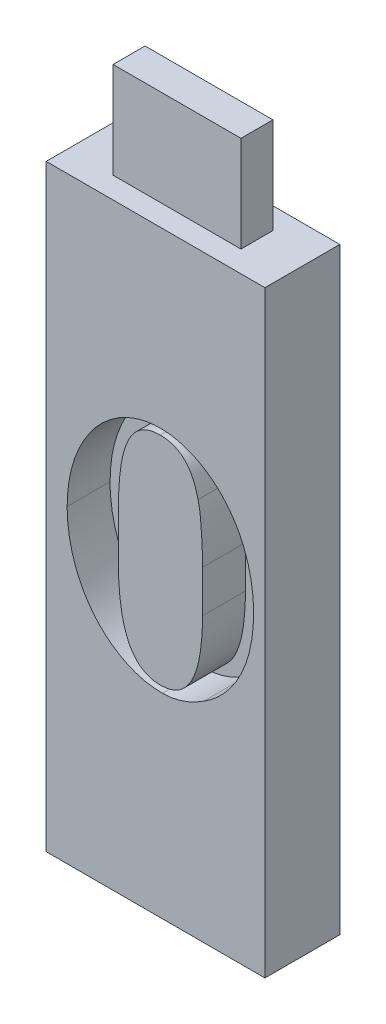
from build123d import *

# Parameters (mm, degrees)
SKETCH1_W           = 17.38
SKETCH1_H           = 47.498
BOSS_EXTRUDE1_DEPTH = 5.95
CUT_EXTRUDE1_DEPTH  = 3.41
SKETCH3_W           = 10.16
SKETCH3_H           = 2.54
BOSS_EXTRUDE2_DEPTH = 7.62


with BuildPart() as part:
    # Sketch1 → Boss-Extrude1 (new body)
    with BuildSketch(Plane.XY):
        Rectangle(SKETCH1_W, SKETCH1_H)
    extrude(amount=BOSS_EXTRUDE1_DEPTH)

    # Sketch2 → Cut-Extrude1 (cut)
    with BuildSketch(Plane.XY.offset(5.95)):
        with BuildLine():
            add(Edge.make_bspline(
                [(0.550302732, -8.226542522), (0.379735674, -8.222982783), (0.040169774, -8.215896034), (-0.463839474, -8.15812923), (-0.957953156, -8.065305599), (-1.440722609, -7.93397308), (-1.914246856, -7.765779149), (-2.375520379, -7.555268135), (-2.829688826, -7.311649662), (-3.271985998, -7.033523648), (-3.695622296, -6.719710376), (-4.100608986, -6.379462985), (-4.482356898, -6.010283848), (-4.834867943, -5.609039062), (-5.170252218, -5.186152795), (-5.479691278, -4.732982281), (-5.767177385, -4.252361088), (-6.026195622, -3.745122286), (-6.262649235, -3.220813492), (-6.463385677, -2.677755241), (-6.63458604, -2.121971034), (-6.777705411, -1.554373675), (-6.884857685, -0.974513718), (-6.963012588, -0.382925268), (-7.013958172, 0.222378933), (-7.018848737, 0.631170896), (-7.021320272, 0.837761211)],
                knots=[0, 0, 0, 0, 0.935229359, 1.861860104, 2.778365642, 3.690213086, 4.602953262, 5.531139642, 6.468158725, 7.427752723, 8.393775505, 9.35721743, 10.326918663, 11.30305363, 12.284324182, 13.285316018, 14.310199044, 15.353667505, 16.407211588, 17.462763663, 18.526572315, 19.595421863, 20.671172186, 21.758519085, 22.867227609, 24, 24, 24, 24], degree=3))
            add(Edge.make_bspline(
                [(-7.021320272, 0.837761211), (-7.019018375, 1.043132905), (-7.014463737, 1.449490733), (-6.960970524, 2.051780421), (-6.891552806, 2.643471616), (-6.774881724, 3.22130983), (-6.639867653, 3.790672361), (-6.466996952, 4.345851556), (-6.265031095, 4.888970049), (-6.033789785, 5.416782083), (-5.779586146, 5.927183042), (-5.493336967, 6.408001352), (-5.191668967, 6.865492143), (-4.867252969, 7.295030074), (-4.519766848, 7.695667308), (-4.148181052, 8.065835718), (-3.757073623, 8.410721014), (-3.34206406, 8.721642737), (-2.915815576, 9.008687913), (-2.469246401, 9.247584189), (-2.017296753, 9.462224383), (-1.549212621, 9.625945007), (-1.073318626, 9.765137224), (-0.584345141, 9.855228751), (-0.084297826, 9.914279226), (0.252836758, 9.921036178), (0.42342487, 9.924455156)],
                knots=[0, 0, 0, 0, 1.133047579, 2.241899783, 3.335215261, 4.419027891, 5.492968413, 6.563480614, 7.625684211, 8.689373082, 9.742419676, 10.770259333, 11.775568516, 12.765501156, 13.738725683, 14.699866048, 15.658232057, 16.613840314, 17.560131627, 18.490982804, 19.406287858, 20.318317554, 21.224515383, 22.140052105, 23.058877329, 24, 24, 24, 24], degree=3))
            add(Edge.make_bspline(
                [(0.42342487, 9.924455156), (0.559148281, 9.921645508), (0.832560203, 9.915985532), (1.243556078, 9.86754079), (1.660769686, 9.798955016), (2.079767463, 9.691960066), (2.500803763, 9.563498986), (2.916875885, 9.402970456), (3.324320864, 9.20650682), (3.725724779, 8.983747658), (4.116057738, 8.734840571), (4.491372535, 8.460890619), (4.850047767, 8.162570258), (5.075596578, 7.946758141), (5.1888081, 7.838433835)],
                knots=[0, 0, 0, 0, 0.915509886, 1.844275157, 2.789506648, 3.766658426, 4.759580674, 5.758727315, 6.772399487, 7.809398841, 8.854855904, 9.894060884, 10.942949104, 12, 12, 12, 12], degree=3))
            add(Edge.make_bspline(
                [(5.1888081, 7.838433835), (5.389513895, 7.625274141), (5.793462123, 7.196260714), (6.305371236, 6.463621807), (6.75436753, 5.667322469), (7.122251761, 4.802237473), (7.423384955, 3.884299926), (7.633961726, 2.916595545), (7.76448607, 1.904889958), (7.778790351, 1.215067432), (7.786072571, 0.863883124)],
                knots=[0, 0, 0, 0, 0.919193343, 1.850003994, 2.80051803, 3.788248458, 4.799621584, 5.832655484, 6.896618542, 8, 8, 8, 8], degree=3))
            add(Edge.make_bspline(
                [(7.786072571, 0.863883124), (7.78352135, 0.647353624), (7.778470942, 0.218710705), (7.728707805, -0.415441181), (7.646780013, -1.034640035), (7.530912683, -1.637393561), (7.386051211, -2.223133728), (7.210848244, -2.789509257), (7.001599425, -3.333806008), (6.762418257, -3.857277855), (6.494119995, -4.359757078), (6.189400077, -4.837839702), (5.857936501, -5.297417839), (5.49711839, -5.733205631), (5.11051594, -6.138422567), (4.702735067, -6.510368516), (4.273224882, -6.842804833), (3.972375106, -7.039318089), (3.823005232, -7.136885589)],
                knots=[0, 0, 0, 0, 1.113772475, 2.204829758, 3.27005864, 4.325555321, 5.360779408, 6.372800007, 7.37346729, 8.358543946, 9.331995144, 10.301336045, 11.272892343, 12.245459715, 13.209547844, 14.151832625, 15.082397426, 16, 16, 16, 16], degree=3))
            add(Edge.make_bspline(
                [(3.823005232, -7.136885589), (3.683147268, -7.222635548), (3.409480365, -7.390426678), (2.994828528, -7.617684008), (2.579610392, -7.803303161), (2.168546265, -7.957578038), (1.759611301, -8.078012453), (1.354366193, -8.164644128), (0.950796586, -8.213781885), (0.683522897, -8.222297827), (0.550302732, -8.226542522)],
                knots=[0, 0, 0, 0, 1.125879178, 2.203062722, 3.242368383, 4.244546476, 5.214349521, 6.165371228, 7.085545794, 8, 8, 8, 8], degree=3))
        make_face()
        with BuildLine():
            Line((-2.961228686, 2.472246611), (-2.961228686, -0.774333977))
            add(Edge.make_bspline(
                [(-2.961228686, -0.774333977), (-2.959967414, -1.061739722), (-2.957525343, -1.618214071), (-2.913735758, -2.423346557), (-2.85314572, -3.170531032), (-2.764518939, -3.859438567), (-2.648829977, -4.489436798), (-2.514239059, -5.064508473), (-2.34558364, -5.578937047), (-2.157613001, -6.039786153), (-1.937036422, -6.441665454), (-1.688349536, -6.790544547), (-1.412867317, -7.087851968), (-1.105878525, -7.330815974), (-0.771392176, -7.520290022), (-0.406109176, -7.649721448), (-0.015966549, -7.736110927), (0.255015986, -7.744563056), (0.393571255, -7.748884688)],
                knots=[0, 0, 0, 0, 1.600918194, 3.099694165, 4.490651416, 5.776535035, 6.967210561, 8.058031995, 9.063903489, 9.980236553, 10.826977267, 11.611606621, 12.361723182, 13.077105204, 13.784521788, 14.492616884, 15.229264454, 16, 16, 16, 16], degree=3))
            add(Edge.make_bspline(
                [(0.393571255, -7.748884688), (0.528245131, -7.743778256), (0.791040711, -7.733813831), (1.172625546, -7.658529716), (1.52755677, -7.529237818), (1.857994163, -7.353860426), (2.162648136, -7.126013205), (2.433191301, -6.842648648), (2.682181228, -6.513316438), (2.906762463, -6.134934559), (3.098668036, -5.70286344), (3.264765351, -5.222717393), (3.41242016, -4.695082575), (3.523579553, -4.114111113), (3.619116063, -3.484551491), (3.677799548, -2.803976451), (3.722465518, -2.074804922), (3.724782967, -1.571754083), (3.725980985, -1.31169904)],
                knots=[0, 0, 0, 0, 0.799284555, 1.559682205, 2.297915387, 3.034706454, 3.773235106, 4.546189228, 5.35267469, 6.22028085, 7.152378913, 8.154412891, 9.234837652, 10.402226976, 11.66392272, 13.013895726, 14.456316111, 16, 16, 16, 16], degree=3))
            Line((3.725980985, -1.31169904), (3.725980985, 2.02071069))
            add(Edge.make_bspline(
                [(3.725980985, 2.02071069), (3.723748812, 2.257046674), (3.71936631, 2.721053283), (3.708560971, 3.40434293), (3.670819489, 4.059661491), (3.633719336, 4.679578677), (3.580286013, 5.245401301), (3.527872185, 5.741345681), (3.463618752, 6.156666795), (3.405129076, 6.40324308), (3.378932715, 6.513679687)],
                knots=[0, 0, 0, 0, 1.256484259, 2.466898997, 3.63225641, 4.745570288, 5.768126857, 6.653192896, 7.396791916, 8, 8, 8, 8], degree=3))
            add(Edge.make_bspline(
                [(3.378932715, 6.513679687), (3.320948737, 6.744215447), (3.210519313, 7.183266572), (2.967701416, 7.785371154), (2.672577177, 8.299006644), (2.320734987, 8.721868888), (1.906870016, 9.046189335), (1.444126514, 9.282221464), (0.924296657, 9.424668031), (0.55992772, 9.439245863), (0.371181044, 9.446797322)],
                knots=[0, 0, 0, 0, 1.239636621, 2.360865202, 3.376378042, 4.320723676, 5.213018588, 6.101502634, 7.016559783, 8, 8, 8, 8], degree=3))
            add(Edge.make_bspline(
                [(0.371181044, 9.446797322), (0.183805449, 9.438721037), (-0.178748844, 9.423094179), (-0.695940302, 9.287727329), (-1.154051557, 9.05336189), (-1.488973453, 8.787875802), (-1.719418951, 8.527231967), (-1.889320993, 8.311817875), (-2.042444584, 8.067599792), (-2.177811432, 7.796765191), (-2.311332426, 7.50616398), (-2.42423477, 7.187961886), (-2.529779888, 6.84706081), (-2.621917406, 6.480649791), (-2.706054572, 6.086538044), (-2.769578415, 5.66104142), (-2.830815218, 5.205995831), (-2.878464235, 4.719303951), (-2.91578194, 4.201662227), (-2.939863819, 3.652856534), (-2.961426072, 3.073215175), (-2.961295697, 2.676269351), (-2.961228686, 2.472246611)],
                knots=[0, 0, 0, 0, 1.298765628, 2.512990303, 3.674827545, 4.847513772, 5.452475075, 6.086065062, 6.74935122, 7.448024762, 8.185900438, 8.966790838, 9.788537819, 10.6614505, 11.587369526, 12.583477292, 13.645459279, 14.77306755, 15.9758581, 17.246032595, 18.584512186, 20, 20, 20, 20], degree=3))
        make_face(mode=Mode.SUBTRACT)
    extrude(amount=-CUT_EXTRUDE1_DEPTH, mode=Mode.SUBTRACT)

    # Sketch3 → Boss-Extrude2 (add)
    with BuildSketch(Plane(origin=(0, 23.749, 0), x_dir=(1, 0, 0), z_dir=(0, 1, 0))):
        with Locations((0, -2.975)):
            Rectangle(SKETCH3_W, SKETCH3_H)
    extrude(amount=BOSS_EXTRUDE2_DEPTH)


solid = part.part
